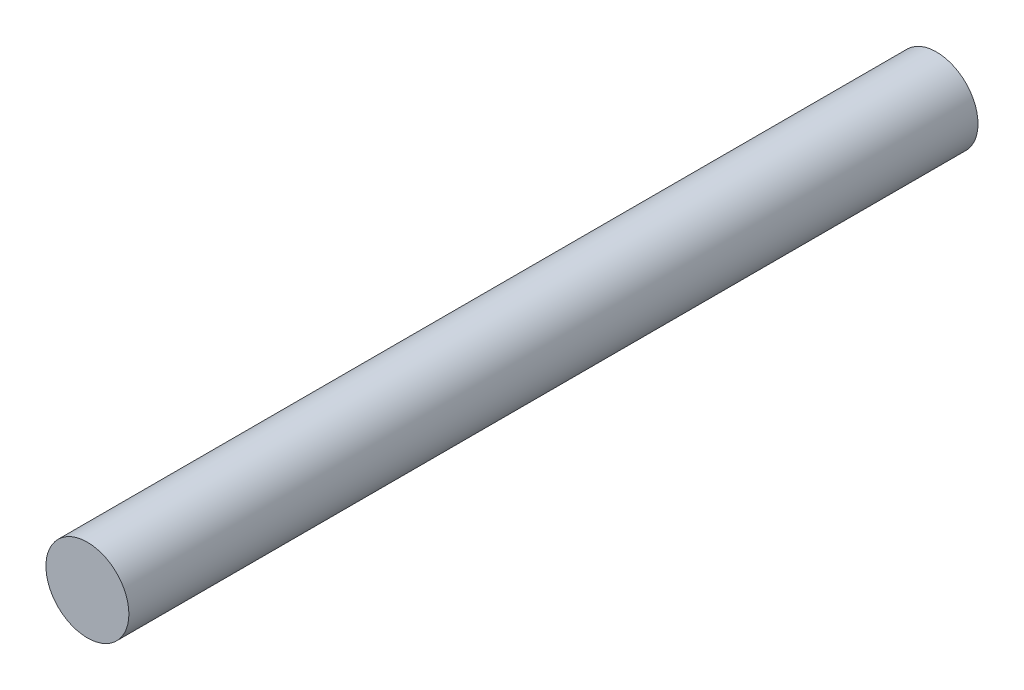
from build123d import *

# Parameters (mm, degrees)
SKETCH1_R           = 6.35
BOSS_EXTRUDE1_DEPTH = 130


with BuildPart() as part:
    # Sketch1 → Boss-Extrude1 (new body)
    with BuildSketch(Plane.XY):
        with Locations((-67.890147022, 12.139297812)):
            Circle(SKETCH1_R)
    extrude(amount=BOSS_EXTRUDE1_DEPTH)


solid = part.part
